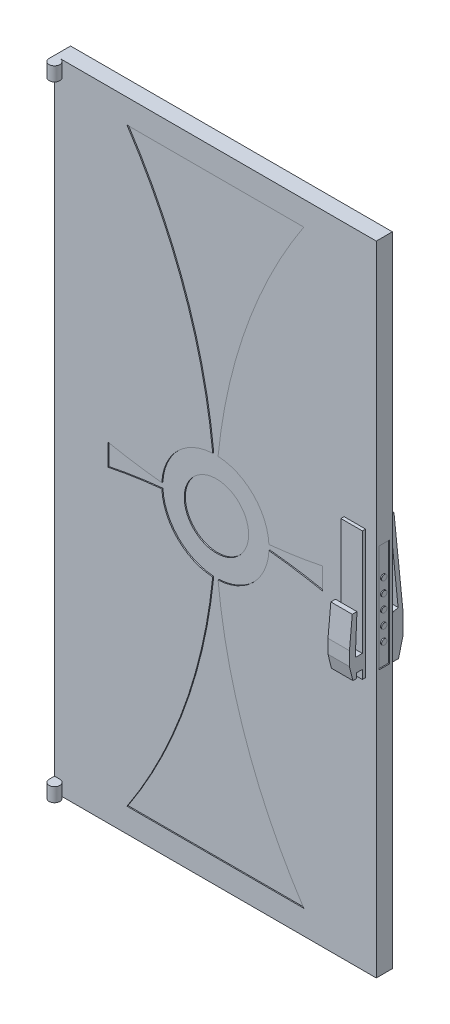
from build123d import *

# Parameters (mm, degrees)
SKETCH_1_W           = 30
SKETCH_1_H           = 59.5
EXTRUDE_1_DEPTH      = 1.5
SKETCH_2_W           = 20
SKETCH_2_H           = 55
CUT_EXTRUDE_1_DEPTH  = 0.1
SKETCH_3_R           = 5
EXTRUDE_2_DEPTH      = 0.1
EXTRUDE_3_DEPTH      = 0.1
CUT_EXTRUDE_START    = -0.1
SKETCH_5_R           = 5
CUT_EXTRUDE_2_DEPTH  = 0.1
SKETCH_6_R           = 3
CUT_EXTRUDE_3_DEPTH  = 0.1
CUT_EXTRUDE_4_DEPTH  = 0.1
SKETCH_8_R           = 3
CUT_EXTRUDE_5_DEPTH  = 0.1
SKETCH_9_W           = 1
SKETCH_9_H           = 10
CUT_EXTRUDE_6_DEPTH  = 0.1
SKETCH_10_R          = 0.25
EXTRUDE_4_DEPTH      = 0.1
SKETCH_11_W          = 2
SKETCH_11_H          = 12
EXTRUDE_5_DEPTH      = 1.5
CUT_EXTRUDE_7_DEPTH  = 42.654081433
SKETCH_13_W          = 2
SKETCH_13_H          = 12
EXTRUDE_6_DEPTH      = 2
CUT_EXTRUDE_8_DEPTH  = 42.654081433
CUT_EXTRUDE_9_DEPTH  = 42.654081433
CUT_EXTRUDE_10_DEPTH = 42.654081433
SKETCH_18_R          = 0.5
EXTRUDE_7_DEPTH      = 59.5
SKETCH_19_W          = 1
SKETCH_19_H          = 56.9
CUT_EXTRUDE_11_DEPTH = 2


with BuildPart() as part:
    # 草圖1 → 填料-伸長1 (new body)
    with BuildSketch(Plane.XY):
        Rectangle(SKETCH_1_W, SKETCH_1_H)
    extrude(amount=EXTRUDE_1_DEPTH)

    # 草圖2 → 除料-伸長1 (cut)
    with BuildSketch(Plane.XY.offset(1.5)):
        Rectangle(SKETCH_2_W, SKETCH_2_H)
    extrude(amount=-CUT_EXTRUDE_1_DEPTH, mode=Mode.SUBTRACT)

    # 草圖3 → 填料-伸長2 (add)
    with BuildSketch(Plane.XY.offset(1.4)):
        Circle(SKETCH_3_R)
    extrude(amount=EXTRUDE_2_DEPTH)

    # 草圖4 → 填料-伸長3 (add)
    with BuildSketch(Plane.XY.offset(1.4)):
        with BuildLine():
            ThreePointArc((4.993746089, 0.25), (7.506502742, 0.566687178), (10, 1.010205144))
            Line((10, 1.010205144), (10, 27.5))
            Line((10, 27.5), (8.241767279, 27.5))
            ThreePointArc((8.241767279, 27.5), (2.882359671, 16.731048078), (0.25, 4.993746089))
            ThreePointArc((0.25, 4.993746089), (3.535533906, 3.535533906), (4.993746089, 0.25))
        make_face()
        with BuildLine():
            ThreePointArc((0.25, -4.993746089), (2.882359671, -16.731048078), (8.241767279, -27.5))
            Line((8.241767279, -27.5), (10, -27.5))
            Line((10, -27.5), (10, -1.010205144))
            ThreePointArc((10, -1.010205144), (7.506502742, -0.566687178), (4.993746089, -0.25))
            ThreePointArc((4.993746089, -0.25), (3.535533906, -3.535533906), (0.25, -4.993746089))
        make_face()
        with BuildLine():
            Line((-10, -27.5), (-8.241767279, -27.5))
            ThreePointArc((-8.241767279, -27.5), (-2.882359671, -16.731048078), (-0.25, -4.993746089))
            ThreePointArc((-0.25, -4.993746089), (-3.535533906, -3.535533906), (-4.993746089, -0.25))
            ThreePointArc((-4.993746089, -0.25), (-7.506502742, -0.566687178), (-10, -1.010205144))
            Line((-10, -1.010205144), (-10, -27.5))
        make_face()
        with BuildLine():
            Line((-10, 27.5), (-10, 1.010205144))
            ThreePointArc((-10, 1.010205144), (-7.506502742, 0.566687178), (-4.993746089, 0.25))
            ThreePointArc((-4.993746089, 0.25), (-3.535533906, 3.535533906), (-0.25, 4.993746089))
            ThreePointArc((-0.25, 4.993746089), (-2.882359671, 16.731048078), (-8.241767279, 27.5))
            Line((-8.241767279, 27.5), (-10, 27.5))
        make_face()
    extrude(amount=EXTRUDE_3_DEPTH)

    # 草圖5 → 除料-伸長2 (cut)
    with BuildSketch(Plane.XY.offset(1.5).offset(CUT_EXTRUDE_START)):
        Circle(SKETCH_5_R)
    extrude(amount=CUT_EXTRUDE_2_DEPTH, mode=Mode.SUBTRACT)

    # 草圖6 → 除料-伸長3 (cut)
    with BuildSketch(Plane.XY.offset(1.4)):
        Circle(SKETCH_6_R)
    extrude(amount=-CUT_EXTRUDE_3_DEPTH, mode=Mode.SUBTRACT)

    # 草圖7 → 除料-伸長4 (cut)
    with BuildSketch(Plane(origin=(0, 0, 0), x_dir=(-1, 0, 0), z_dir=(0, 0, -1))):
        with BuildLine():
            Line((-8.241767279, -27.5), (8.241767279, -27.5))
            ThreePointArc((8.241767279, -27.5), (2.882359671, -16.731048078), (0.25, -4.993746089))
            ThreePointArc((0.25, -4.993746089), (3.535533906, -3.535533906), (4.993746089, -0.25))
            ThreePointArc((4.993746089, -0.25), (7.506502742, -0.566687178), (10, -1.010205144))
            Line((10, -1.010205144), (10, 1.010205144))
            ThreePointArc((10, 1.010205144), (7.506502742, 0.566687178), (4.993746089, 0.25))
            ThreePointArc((4.993746089, 0.25), (3.535533906, 3.535533906), (0.25, 4.993746089))
            ThreePointArc((0.25, 4.993746089), (2.882359671, 16.731048078), (8.241767279, 27.5))
            Line((8.241767279, 27.5), (-8.241767279, 27.5))
            ThreePointArc((-8.241767279, 27.5), (-2.882359671, 16.731048078), (-0.25, 4.993746089))
            ThreePointArc((-0.25, 4.993746089), (-3.535533906, 3.535533906), (-4.993746089, 0.25))
            ThreePointArc((-4.993746089, 0.25), (-7.506502742, 0.566687178), (-10, 1.010205144))
            Line((-10, 1.010205144), (-10, -1.010205144))
            ThreePointArc((-10, -1.010205144), (-7.506502742, -0.566687178), (-4.993746089, -0.25))
            ThreePointArc((-4.993746089, -0.25), (-3.535533906, -3.535533906), (-0.25, -4.993746089))
            ThreePointArc((-0.25, -4.993746089), (-2.882359671, -16.731048078), (-8.241767279, -27.5))
        make_face()
    extrude(amount=-CUT_EXTRUDE_4_DEPTH, mode=Mode.SUBTRACT)

    # 草圖8 → 除料-伸長5 (cut)
    with BuildSketch(Plane(origin=(0, 0, 0.1), x_dir=(-1, 0, 0), z_dir=(0, 0, -1)).offset(CUT_EXTRUDE_START)):
        with Locations(Location((0, 0, 0), (0, 0, 180))):
            Circle(SKETCH_8_R)
    extrude(amount=CUT_EXTRUDE_5_DEPTH, mode=Mode.SUBTRACT)

    # 草圖9 → 除料-伸長6 (cut)
    with BuildSketch(Plane(origin=(15, 0, 0), x_dir=(0, 0, -1), z_dir=(1, 0, 0))):
        with Locations((-0.75, 0)):
            Rectangle(SKETCH_9_W, SKETCH_9_H)
    extrude(amount=-CUT_EXTRUDE_6_DEPTH, mode=Mode.SUBTRACT)

    # 草圖10 → 填料-伸長4 (add)
    with BuildSketch(Plane(origin=(14.9, 0, 0), x_dir=(0, 0, -1), z_dir=(1, 0, 0))):
        with Locations((-0.75, -3)):
            Circle(SKETCH_10_R)
        with Locations((-0.75, -1.7)):
            Circle(SKETCH_10_R)
        with Locations((-0.75, -0.4)):
            Circle(SKETCH_10_R)
        with Locations((-0.75, 0.9)):
            Circle(SKETCH_10_R)
        with Locations((-0.75, 2.2)):
            Circle(SKETCH_10_R)
    extrude(amount=EXTRUDE_4_DEPTH)

    # 草圖11 → 填料-伸長5 (add)
    with BuildSketch(Plane.XY.offset(1.5)):
        with Locations((13, 0)):
            Rectangle(SKETCH_11_W, SKETCH_11_H)
    extrude(amount=EXTRUDE_5_DEPTH)

    # 草圖12 → 除料-伸長7 (cut, through all)
    with BuildSketch(Plane(origin=(14, 0, 0), x_dir=(0, 0, -1), z_dir=(1, 0, 0))):
        Polygon((-1.8, 6), (-1.8, -3.892813963), (-2.45595706, -3.892813963), (-2.301062562, -0.267088334), (-2.736577143, -0.267088334), (-3, -3.073435974), (-3, 6), align=None)
        Polygon((-3, -6), (-1.8, -6), (-1.8, -5.188306953), (-2.363031893, -5.188306953), (-2.363031893, -5.650911739), (-2.678275837, -5.650911739), (-3, -4.356848884), align=None)
    extrude(amount=-CUT_EXTRUDE_7_DEPTH, mode=Mode.SUBTRACT)

    # 草圖13 → 填料-伸長6 (add)
    with BuildSketch(Plane(origin=(0, 0, 0), x_dir=(-1, 0, 0), z_dir=(0, 0, -1))):
        with Locations((-13, 0)):
            Rectangle(SKETCH_13_W, SKETCH_13_H)
    extrude(amount=EXTRUDE_6_DEPTH)

    # 草圖14 → 除料-伸長8 (cut, through all)
    with BuildSketch(Plane(origin=(14, 0, 0), x_dir=(0, 0, -1), z_dir=(1, 0, 0))):
        Polygon((1.152930519, 6), (2, -2.477443224), (2, 6), align=None)
        Polygon((2, -4.322370965), (1.57646526, -6), (2, -6), align=None)
    extrude(amount=-CUT_EXTRUDE_8_DEPTH, mode=Mode.SUBTRACT)

    # 草圖15 → 除料-伸長9 (cut, through all)
    with BuildSketch(Plane(origin=(14, 0, 0), x_dir=(0, 0, -1), z_dir=(1, 0, 0))):
        Polygon((0.753392093, 6), (1.537923786, -1.851567128), (1.145657939, -1.979765392), (0.570903406, 3.772358885), (0, 3.772358885), (0, 6), align=None)
    extrude(amount=-CUT_EXTRUDE_9_DEPTH, mode=Mode.SUBTRACT)

    # 草圖17 → 除料-伸長10 (cut, through all)
    with BuildSketch(Plane(origin=(14, 0, 0), x_dir=(0, 0, -1), z_dir=(1, 0, 0))):
        Polygon((0.570903406, 3.772358885), (0.570903406, -1.986165117), (1.145657939, -1.979765392), align=None)
    extrude(amount=-CUT_EXTRUDE_10_DEPTH, mode=Mode.SUBTRACT)

    # 草圖18 → 填料-伸長7 (add, through all)
    with BuildSketch(Plane(origin=(0, 29.75, 0), x_dir=(1, 0, 0), z_dir=(0, 1, 0))):
        with Locations((-14.5, -2)):
            Circle(SKETCH_18_R)
        with BuildLine():
            Line((-14.5, -1.5), (-15, -1.5))
            Line((-15, -1.5), (-15, -2))
            ThreePointArc((-15, -2), (-14.853553391, -1.646446609), (-14.5, -1.5))
        make_face()
    extrude(amount=-EXTRUDE_7_DEPTH)

    # 草圖19 → 除料-伸長11 (cut)
    with BuildSketch(Plane.ZY.offset(15)):
        with Locations((2, 0)):
            Rectangle(SKETCH_19_W, SKETCH_19_H)
    extrude(amount=-CUT_EXTRUDE_11_DEPTH, mode=Mode.SUBTRACT)


solid = part.part
